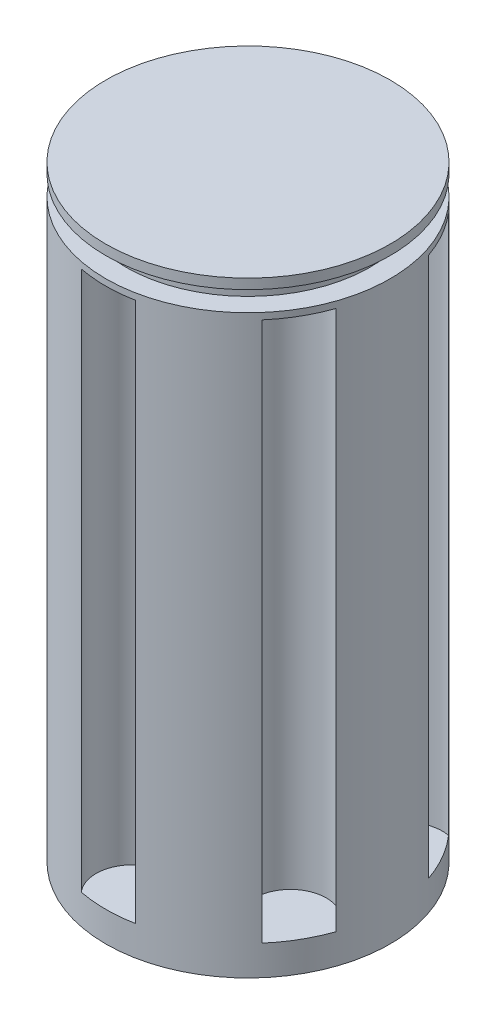
from build123d import *

# Parameters (mm, degrees)
BOSS_EXTRUDE1_DEPTH = 150
CUT_EXTRUDE7_START  = -7.5
SKETCH2_R           = 9
CUT_EXTRUDE7_DEPTH  = 135
CIRPATTERN1_COUNT   = 6
SKETCH3_R           = 19.05
CUT_EXTRUDE8_DEPTH  = 159.205648445
CUT_EXTRUDE9_START  = -5.9
SKETCH5_R           = 35.56
CUT_EXTRUDE9_DEPTH  = 5.9
SKETCH6_R           = 30.56
BOSS_EXTRUDE2_DEPTH = 5
SKETCH7_R           = 35.56
BOSS_EXTRUDE3_DEPTH = 2.5


with BuildPart() as part:
    # Sketch1 → Boss-Extrude1 (new body)
    with BuildSketch(Plane(origin=(0, 0, 0), x_dir=(1, 0, 0), z_dir=(0, 1, 0))):
        with BuildLine():
            ThreePointArc((-35.56, 0), (0, 35.56), (35.56, 0))
            ThreePointArc((35.56, 0), (0, -35.56), (-35.56, 0))
        make_face()
    extrude(amount=BOSS_EXTRUDE1_DEPTH)

    # Sketch2 → Cut-Extrude7 (cut)
    with BuildSketch(Plane(origin=(0, 0, 0), x_dir=(-1, 0, 0), z_dir=(0, -1, 0)).offset(CUT_EXTRUDE7_START)):
        with Locations((0, 29)):
            Circle(SKETCH2_R)
    cut_extrude7 = extrude(amount=-CUT_EXTRUDE7_DEPTH, mode=Mode.SUBTRACT)

    # CirPattern1: Cut-Extrude7 ×6 about axis
    cirpattern1_axis = Axis((0, 0, 0), (0, 1, 0))
    for i in range(1, CIRPATTERN1_COUNT):
        add(cut_extrude7.rotate(cirpattern1_axis, i * 360 / CIRPATTERN1_COUNT), mode=Mode.SUBTRACT)

    # Sketch3 → Cut-Extrude8 (cut, through all)
    with BuildSketch(Plane(origin=(0, 0, 0), x_dir=(-1, 0, 0), z_dir=(0, -1, 0))):
        with Locations(Location((0, 0, 0), (0, 0, 90))):
            Circle(SKETCH3_R)
    extrude(amount=-CUT_EXTRUDE8_DEPTH, mode=Mode.SUBTRACT)

    # Sketch5 → Cut-Extrude9 (cut)
    with BuildSketch(Plane(origin=(0, 150, 0), x_dir=(1, 0, 0), z_dir=(0, 1, 0)).offset(CUT_EXTRUDE9_START)):
        with Locations(Location((0, 0, 0), (0, 0, 90))):
            Circle(SKETCH5_R)
    extrude(amount=CUT_EXTRUDE9_DEPTH, mode=Mode.SUBTRACT)

    # Sketch6 → Boss-Extrude2 (add)
    with BuildSketch(Plane(origin=(0, 144.1, 0), x_dir=(1, 0, 0), z_dir=(0, 1, 0))):
        with Locations(Location((0, 0, 0), (0, 0, 270))):
            Circle(SKETCH6_R)
    extrude(amount=BOSS_EXTRUDE2_DEPTH)

    # Sketch7 → Boss-Extrude3 (add)
    with BuildSketch(Plane(origin=(0, 149.1, 0), x_dir=(1, 0, 0), z_dir=(0, 1, 0))):
        with Locations(Location((0, 0, 0), (0, 0, 90))):
            Circle(SKETCH7_R)
    extrude(amount=BOSS_EXTRUDE3_DEPTH)


solid = part.part
